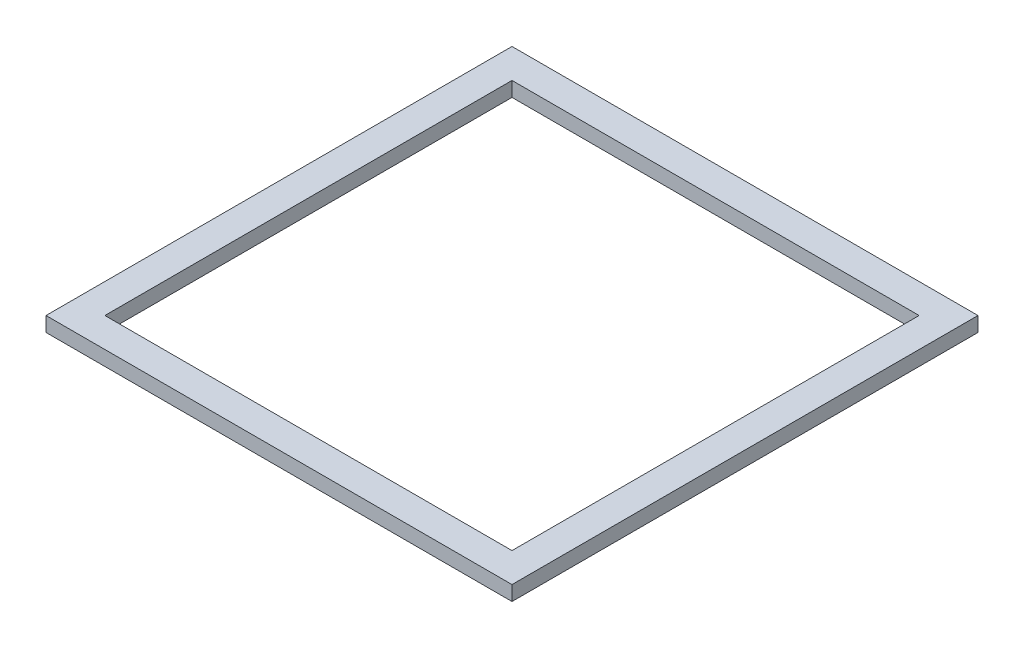
from build123d import *

# Parameters (mm, degrees)
SKETCH1_W           = 47.5
SKETCH1_H           = 47.5
SKETCH1_W_2         = 41.5
SKETCH1_H_2         = 41.5
BOSS_EXTRUDE1_DEPTH = 1.5


with BuildPart() as part:
    # Sketch1 → Boss-Extrude1 (new body)
    with BuildSketch(Plane(origin=(0, 0, 0), x_dir=(1, 0, 0), z_dir=(0, 1, 0))):
        with Locations((23.75, -23.75)):
            Rectangle(SKETCH1_W, SKETCH1_H)
        with Locations((23.75, -23.75)):
            Rectangle(SKETCH1_W_2, SKETCH1_H_2, mode=Mode.SUBTRACT)
    extrude(amount=BOSS_EXTRUDE1_DEPTH)


solid = part.part
